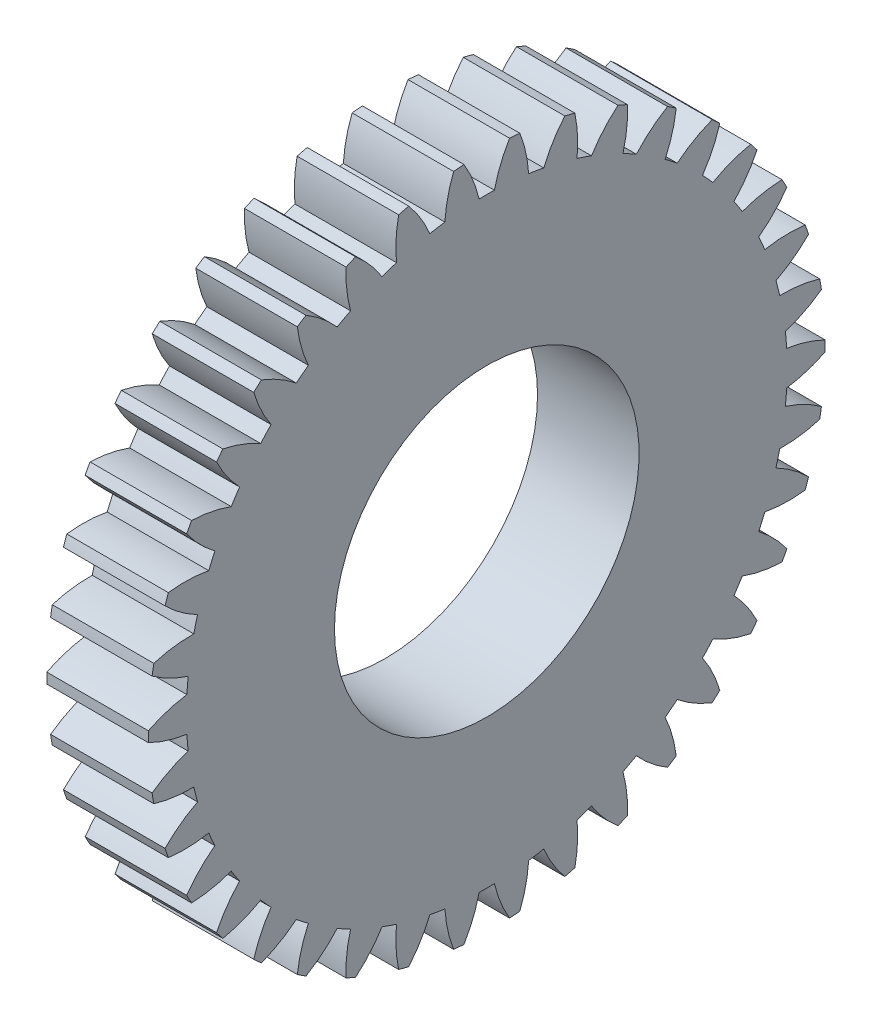
from build123d import *

# Parameters (mm, degrees)
BASPROSKE_W     = 3
BASPROSKE_H     = 10
TOOTHCUT_DEPTH  = 15.456832295
TEETHCUTS_COUNT = 38
TEETHCUTS_ANGLE = 350.526315789
BORSKE_R        = 4.5
BORE_DEPTH      = 50.0000508


with BuildPart() as part:
    # BasProSke → Base-Revolve (revolve)
    with BuildSketch(Plane(origin=(0, 0, 0), x_dir=(1, 0, 0), z_dir=(0, 1, 0)), mode=Mode.PRIVATE) as base_revolve_sk:
        with Locations((1.5, 5)):
            Rectangle(BASPROSKE_W, BASPROSKE_H)
    revolve(base_revolve_sk.sketch.rotate(Axis((-10, 0, 0), (1, 0, 0)), 180), axis=Axis((-10, 0, 0), (1, 0, 0)))

    # TooCutSke → ToothCut (cut, through all)
    with BuildSketch(Plane(origin=(0, 0, 0), x_dir=(0, 0, -1), z_dir=(1, 0, 0))):
        with BuildLine():
            ThreePointArc((0.225646216, 8.871130694), (0, 8.874), (-0.225646216, 8.871130694))
            ThreePointArc((-0.225646216, 8.871130694), (-0.411182885, 9.455149371), (-0.688178469, 10.001752624))
            ThreePointArc((-0.688178469, 10.001752624), (0, 10.0254), (0.688178469, 10.001752624))
            ThreePointArc((0.688178469, 10.001752624), (0.411182885, 9.455149371), (0.225646216, 8.871130694))
        make_face()
    toothcut = extrude(amount=TOOTHCUT_DEPTH, mode=Mode.SUBTRACT)

    # TeethCuts: ToothCut ×38 about axis
    teethcuts_axis = Axis((-10, 0, 0), (1, 0, 0))
    for i in range(1, TEETHCUTS_COUNT):
        add(toothcut.rotate(teethcuts_axis, i * TEETHCUTS_ANGLE / (TEETHCUTS_COUNT - 1)), mode=Mode.SUBTRACT)

    # BorSke → Bore (cut, symmetric)
    with BuildSketch(Plane(origin=(0, 0, 0), x_dir=(0, 0, -1), z_dir=(1, 0, 0))):
        with Locations(Location((0, 0, 0), (0, 0, 180))):
            Circle(BORSKE_R)
    extrude(amount=BORE_DEPTH, both=True, mode=Mode.SUBTRACT)


solid = part.part
